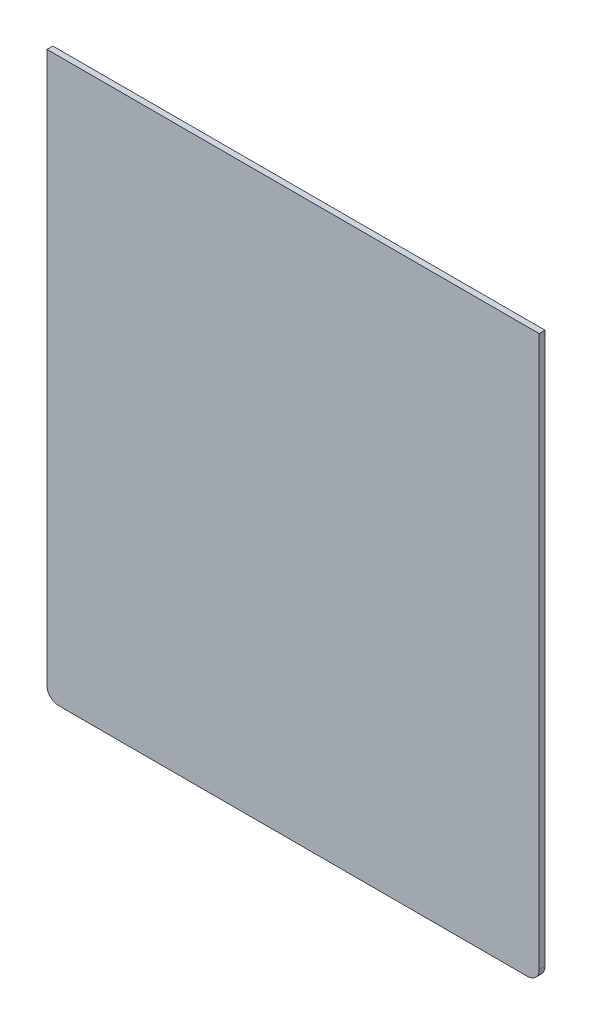
from build123d import *

# Parameters (mm, degrees)
SKETCH_1_W      = 420
SKETCH_1_H      = 480
EXTRUDE_1_DEPTH = 5
FILLET_1_R      = 10


with BuildPart() as part:
    # 草图1 → 凸台-拉伸1 (new body)
    with BuildSketch(Plane.XY):
        Rectangle(SKETCH_1_W, SKETCH_1_H)
    extrude(amount=EXTRUDE_1_DEPTH)

    # 圆角1
    fillet_1_edges = [part.edges().sort_by_distance(p)[0] for p in [
        (210, -240, 2.5),
        (-210, -240, 2.5),
    ]]
    fillet(fillet_1_edges, radius=FILLET_1_R)


solid = part.part
